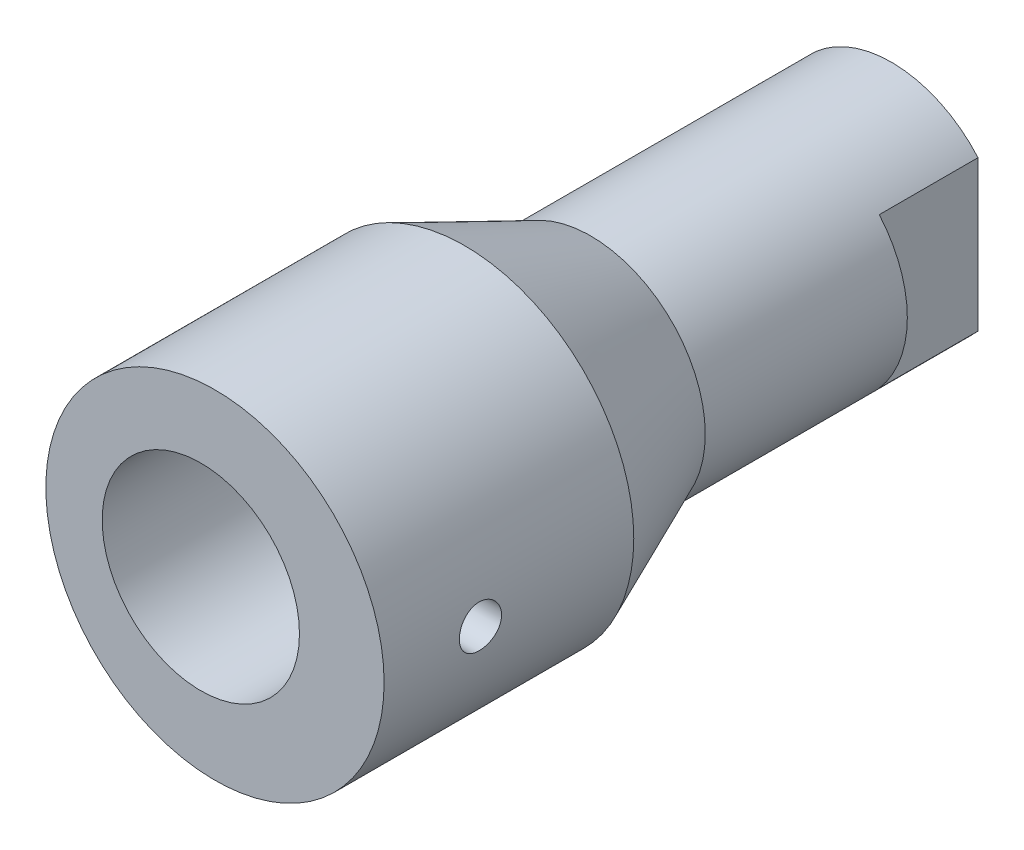
from build123d import *

# Parameters (mm, degrees)
IZIM2_W               = 1.58
IZIM2_H               = 5.56
KES_EKSTR_ZYON1_DEPTH = 5
IZIM6_R               = 5.555
KES_EKSTR_ZYON2_DEPTH = 14.06
IZIM9_R               = 1.19
KES_EKSTR_ZYON3_DEPTH = 14.06


with BuildPart() as part:
    # Çizim1 → Döndür2 (revolve)
    with BuildSketch(Plane(origin=(0, 0, 0), x_dir=(0, 0, -1), z_dir=(1, 0, 0)), mode=Mode.PRIVATE) as d_nd_r2_sk:
        Polygon((-16.346129032, 9.525), (-2.286129032, 9.525), (4.813870968, 6.45), (21.753870968, 6.45), (21.753870968, 0), (-16.346129032, 0), align=None)
    revolve(d_nd_r2_sk.sketch.rotate(Axis((0, 0, 16.346129032), (0, 0, -1)), 90), axis=Axis((0, 0, 16.346129032), (0, 0, -1)))

    # Çizim2 → Kes-Ekstrüzyon1 (cut, symmetric)
    with BuildSketch(Plane(origin=(0, 0, 0), x_dir=(1, 0, 0), z_dir=(0, 1, 0))):
        with Locations((5.66, 18.973870968)):
            Rectangle(IZIM2_W, IZIM2_H)
    extrude(amount=KES_EKSTR_ZYON1_DEPTH, both=True, mode=Mode.SUBTRACT)

    # Çizim6 → Kes-Ekstrüzyon2 (cut)
    with BuildSketch(Plane.XY.offset(16.346129032)):
        with Locations((-0.796682274, 0)):
            Circle(IZIM6_R)
    extrude(amount=-KES_EKSTR_ZYON2_DEPTH, mode=Mode.SUBTRACT)

    # Çizim9 → Kes-Ekstrüzyon3 (cut)
    with BuildSketch(Plane(origin=(0, 0, 0), x_dir=(0, 0, -1), z_dir=(1, 0, 0))):
        with Locations(Location((-10.918037958, 0, 0), (0, 0, 180))):
            Circle(IZIM9_R)
    extrude(amount=KES_EKSTR_ZYON3_DEPTH, mode=Mode.SUBTRACT)


solid = part.part
